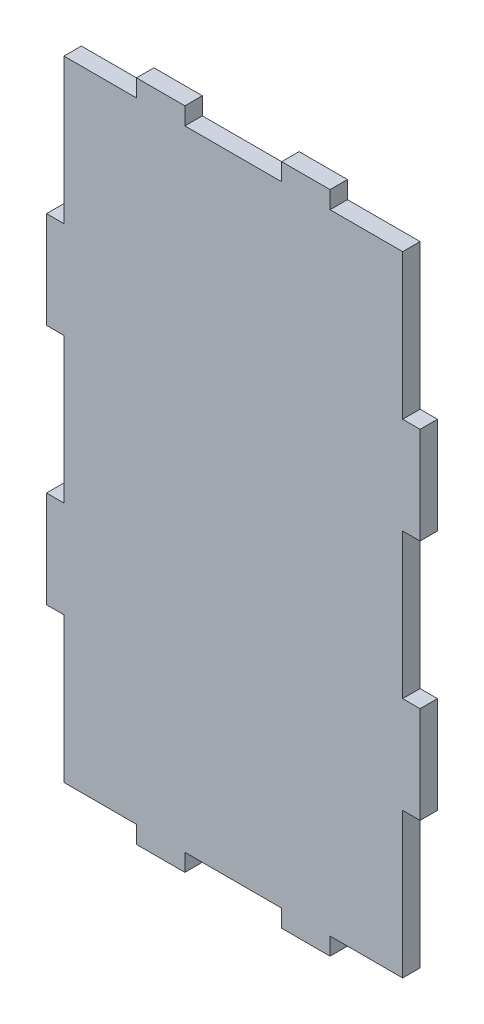
from build123d import *

# Parameters (mm, degrees)
SKETCH1_W           = 98.044
SKETCH1_H           = 174.244
BOSS_EXTRUDE1_DEPTH = 4.572
SKETCH2_W           = 23.622
SKETCH2_H           = 4.572
SKETCH2_W_2         = 25.4
CUT_EXTRUDE1_DEPTH  = 4.572
SKETCH3_W           = 4.572
SKETCH3_H           = 38.1
CUT_EXTRUDE2_DEPTH  = 4.572


with BuildPart() as part:
    # Sketch1 → Boss-Extrude1 (new body)
    with BuildSketch(Plane.XY):
        with Locations((49.022, 87.122)):
            Rectangle(SKETCH1_W, SKETCH1_H)
    extrude(amount=BOSS_EXTRUDE1_DEPTH)

    # Sketch2 → Cut-Extrude1 (cut)
    with BuildSketch(Plane.XY.offset(4.572)):
        with Locations((11.811, 2.286)):
            Rectangle(SKETCH2_W, SKETCH2_H)
        with Locations((49.022, 2.286)):
            Rectangle(SKETCH2_W_2, SKETCH2_H)
        with Locations((86.233, 2.286)):
            Rectangle(SKETCH2_W, SKETCH2_H)
        with Locations((11.811, 171.958)):
            Rectangle(SKETCH2_W, SKETCH2_H)
        with Locations((49.022, 171.958)):
            Rectangle(SKETCH2_W_2, SKETCH2_H)
        with Locations((86.233, 171.958)):
            Rectangle(SKETCH2_W, SKETCH2_H)
    extrude(amount=-CUT_EXTRUDE1_DEPTH, mode=Mode.SUBTRACT)

    # Sketch3 → Cut-Extrude2 (cut)
    with BuildSketch(Plane.XY.offset(4.572)):
        with Locations((2.286, 23.622)):
            Rectangle(SKETCH3_W, SKETCH3_H)
        with Locations((95.758, 23.622)):
            Rectangle(SKETCH3_W, SKETCH3_H)
        with Locations((2.286, 87.122)):
            Rectangle(SKETCH3_W, SKETCH3_H)
        with Locations((2.286, 150.622)):
            Rectangle(SKETCH3_W, SKETCH3_H)
        with Locations((95.758, 150.622)):
            Rectangle(SKETCH3_W, SKETCH3_H)
        with Locations((95.758, 87.122)):
            Rectangle(SKETCH3_W, SKETCH3_H)
    extrude(amount=-CUT_EXTRUDE2_DEPTH, mode=Mode.SUBTRACT)


solid = part.part
